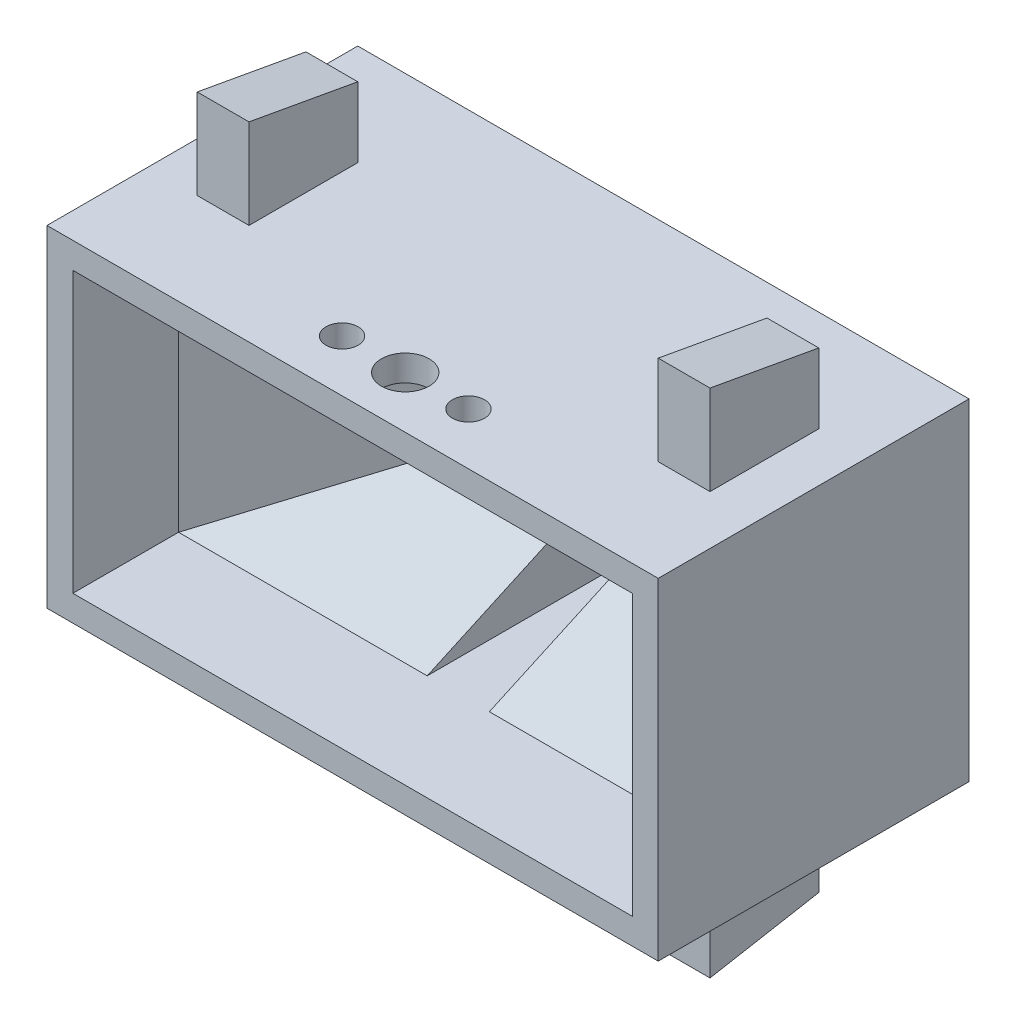
from build123d import *

# Parameters (mm, degrees)
CROQUIS1_W                   = 54
CROQUIS1_H                   = 27
SALIENTE_EXTRUIR1_DEPTH      = 14.8
CROQUIS8_W                   = 6
CROQUIS8_H                   = 27
CORTAR_EXTRUIR2_DEPTH        = 14.8
SALIENTE_EXTRUIR2_DEPTH      = 35
SALIENTE_EXTRUIR2_DEPTH_BACK = 35
CROQUIS12_W                  = 2.5
CROQUIS12_H                  = 27
SALIENTE_EXTRUIR3_DEPTH      = 25
CROQUIS19_W                  = 5.5
CROQUIS19_H                  = 30
CORTAR_EXTRUIR15_DEPTH       = 54.609700615
CROQUIS18_R                  = 2.3
CROQUIS18_R_2                = 1.55
CORTAR_EXTRUIR12_DEPTH       = 2.5
CROQUIS20_W                  = 6
CROQUIS20_H                  = 3.875
CORTAR_EXTRUIR16_DEPTH       = 42.847939017
SALIENTE_EXTRUIR4_DEPTH      = 59
SALIENTE_EXTRUIR4_2_DEPTH    = 59
CROQUIS23_W                  = 4.75
CROQUIS23_H                  = 4.32915245
CROQUIS23_W_2                = 39.5
CROQUIS23_H_2                = 8.6583049
CORTAR_EXTRUIR17_DEPTH       = 44.455086061


with BuildPart() as part:
    # Croquis1 → Saliente-Extruir1 (new body)
    with BuildSketch(Plane.XY):
        Rectangle(CROQUIS1_W, CROQUIS1_H)
    extrude(amount=SALIENTE_EXTRUIR1_DEPTH)

    # Croquis5 → Cortar-Recubrir3 section 0
    with BuildSketch(Plane.XY.offset(14.8)):
        with BuildLine():
            Line((-27, 13.5), (-27, -13.5))
            Line((-27, -13.5), (27, -13.5))
            Line((27, -13.5), (27, 13.5))
            Line((27, 13.5), (-27, 13.5))
        make_face()
    # Croquis6 → Cortar-Recubrir3 section 1
    with BuildSketch(Plane(origin=(0, 0, 0), x_dir=(-1, 0, 0), z_dir=(0, 0, -1))):
        with BuildLine():
            Line((-13.5, -6.75), (13.5, -6.75))
            Line((13.5, -6.75), (13.5, 6.75))
            Line((13.5, 6.75), (-13.5, 6.75))
            Line((-13.5, 6.75), (-13.5, -6.75))
        make_face()
    loft(mode=Mode.SUBTRACT)

    # Croquis8 → Cortar-Extruir2 (cut)
    with BuildSketch(Plane(origin=(0, 0, 0), x_dir=(-1, 0, 0), z_dir=(0, 0, -1))):
        Rectangle(CROQUIS8_W, CROQUIS8_H)
    extrude(amount=-CORTAR_EXTRUIR2_DEPTH, mode=Mode.SUBTRACT)


with BuildPart() as cortar_extruir2_piece_1:
    # of the separate pieces the step leaves, piece 1, a body of its own (cortar_extruir2_pieces)
    add(part.part.solids().sort_by_distance((3, -13.5, 0))[0])



with BuildPart() as cortar_extruir2_piece_2:
    # of the separate pieces the step leaves, piece 2, a body of its own (cortar_extruir2_pieces)
    add(part.part.solids().sort_by_distance((-27, -13.5, 0))[0])


with BuildPart() as cortar_extruir2_piece_1_1:
    add(cortar_extruir2_piece_1.part)

    add(cortar_extruir2_piece_2.part)  # Saliente-Extruir2 merges Cortar-Extruir2 piece 2
    # Croquis10 → Saliente-Extruir2 (add, two sides: drawn at the far end of the back side and taken through both)
    with BuildSketch(Plane(origin=(0, 0, 0), x_dir=(0, 0, -1), z_dir=(1, 0, 0)).offset(-SALIENTE_EXTRUIR2_DEPTH_BACK)):
        Polygon((-14.8, 13.5), (-25, 13.5), (-25, 15.75), (-25, 16), (-24.680771502, 16), (5, 16), (5, 15), (5, -16), (-24.680771502, -16), (-25, -16), (-25, -15.75), (-25, -13.5), (-14.8, -13.5), (0, -13.5), (0, 13.5), align=None)
    extrude(amount=SALIENTE_EXTRUIR2_DEPTH + SALIENTE_EXTRUIR2_DEPTH_BACK)

    # Croquis12 → Saliente-Extruir3 (add)
    with BuildSketch(Plane.XY):
        with Locations((-28.25, 0)):
            Rectangle(CROQUIS12_W, CROQUIS12_H)
        with Locations((28.25, 0)):
            Rectangle(CROQUIS12_W, CROQUIS12_H)
    extrude(amount=SALIENTE_EXTRUIR3_DEPTH)

    # Croquis19 → Cortar-Extruir15 (cut, through all)
    with BuildSketch(Plane(origin=(0, 16, 0), x_dir=(1, 0, 0), z_dir=(0, 1, 0))):
        with Locations((-32.25, -10)):
            Rectangle(CROQUIS19_W, CROQUIS19_H)
        with Locations((32.25, -10)):
            Rectangle(CROQUIS19_W, CROQUIS19_H)
    extrude(amount=-CORTAR_EXTRUIR15_DEPTH, mode=Mode.SUBTRACT)

    # Croquis18 → Cortar-Extruir12 (cut)
    with BuildSketch(Plane(origin=(0, 16, 0), x_dir=(1, 0, 0), z_dir=(0, 1, 0))):
        with Locations(Location((0.081355667, -19.999867625, 0), (0, 0, 270))):
            Circle(CROQUIS18_R)
        with Locations(Location((6.181355666, -20, 0), (0, 0, 270))):
            Circle(CROQUIS18_R_2)
        with Locations(Location((-6.018644331, -20, 0), (0, 0, 270))):
            Circle(CROQUIS18_R_2)
    extrude(amount=-CORTAR_EXTRUIR12_DEPTH, mode=Mode.SUBTRACT)

    # Croquis20 → Cortar-Extruir16 (cut, through all)
    with BuildSketch(Plane.XY):
        with Locations((0, 11.5625)):
            Rectangle(CROQUIS20_W, CROQUIS20_H)
        with Locations((0, -11.5625)):
            Rectangle(CROQUIS20_W, CROQUIS20_H)
    extrude(amount=-CORTAR_EXTRUIR16_DEPTH, mode=Mode.SUBTRACT)


with BuildPart() as body_2:
    # Croquis22 → Saliente-Extruir4 (new body)
    with BuildSketch(Plane(origin=(29.5, 0, 0), x_dir=(0, 0, -1), z_dir=(1, 0, 0))):
        Polygon((-15.25, 16), (-4.75, 16), (-4.75, 22.761406063), (-15.25, 24.6583049), align=None)
    extrude(amount=-SALIENTE_EXTRUIR4_DEPTH)


with BuildPart() as body_3:
    # Croquis22 → Saliente-Extruir4 2 (new body)
    with BuildSketch(Plane(origin=(29.5, 0, 0), x_dir=(0, 0, -1), z_dir=(1, 0, 0))):
        Polygon((-15.25, -16), (-15.25, -24.6583049), (-4.75, -22.761406063), (-4.75, -16), align=None)
    extrude(amount=-SALIENTE_EXTRUIR4_2_DEPTH)


with BuildPart() as cortar_extruir17_tool:
    # Croquis23 → Cortar-Extruir17 (new, through all)
    with BuildSketch(Plane.XY.offset(15.25)):
        with Locations((-27.125, 22.493728675)):
            Rectangle(CROQUIS23_W, CROQUIS23_H)
        with Locations((-27.125, 18.164576225)):
            Rectangle(CROQUIS23_W, CROQUIS23_H)
        with Locations((0, 18.164576225)):
            Rectangle(CROQUIS23_W_2, CROQUIS23_H)
        with Locations((0, 22.493728675)):
            Rectangle(CROQUIS23_W_2, CROQUIS23_H)
        with Locations((27.125, 22.493728675)):
            Rectangle(CROQUIS23_W, CROQUIS23_H)
        with Locations((27.125, 18.164576225)):
            Rectangle(CROQUIS23_W, CROQUIS23_H)
        with Locations((0, -20.32915245)):
            Rectangle(CROQUIS23_W_2, CROQUIS23_H_2)
        with Locations((27.125, -20.32915245)):
            Rectangle(CROQUIS23_W, CROQUIS23_H_2)
        with Locations((-27.125, -20.32915245)):
            Rectangle(CROQUIS23_W, CROQUIS23_H_2)
    extrude(amount=-CORTAR_EXTRUIR17_DEPTH)


with BuildPart() as body_2_1:
    add(body_2.part)

    # Cortar-Extruir17: cut by cortar_extruir17_tool
    add(cortar_extruir17_tool.part, mode=Mode.SUBTRACT)


with BuildPart() as body_3_1:
    add(body_3.part)

    # Cortar-Extruir17: cut by cortar_extruir17_tool
    add(cortar_extruir17_tool.part, mode=Mode.SUBTRACT)


with BuildPart() as cortar_extruir17_piece_1:
    # of the separate pieces the step leaves, piece 1, a body of its own (cortar_extruir17_pieces)
    add(body_2_1.part.solids().sort_by_distance((24.75, 22.761406063, 4.75))[0])


with BuildPart() as cortar_extruir17_piece_2:
    # of the separate pieces the step leaves, piece 2, a body of its own (cortar_extruir17_pieces)
    add(body_2_1.part.solids().sort_by_distance((-19.75, 22.761406063, 4.75))[0])


with BuildPart() as cortar_extruir17_piece_1_of_body_3:
    # of the separate pieces the step leaves, piece 1, a body of its own (cortar_extruir17_pieces_of_body_3)
    add(body_3_1.part.solids().sort_by_distance((-19.75, -24.6583049, 15.25))[0])


with BuildPart() as cortar_extruir17_piece_2_of_body_3:
    # of the separate pieces the step leaves, piece 2, a body of its own (cortar_extruir17_pieces_of_body_3)
    add(body_3_1.part.solids().sort_by_distance((24.75, -24.6583049, 15.25))[0])


solid = Compound([cortar_extruir2_piece_1_1.part, cortar_extruir17_piece_1.part, cortar_extruir17_piece_2.part, cortar_extruir17_piece_1_of_body_3.part, cortar_extruir17_piece_2_of_body_3.part])
